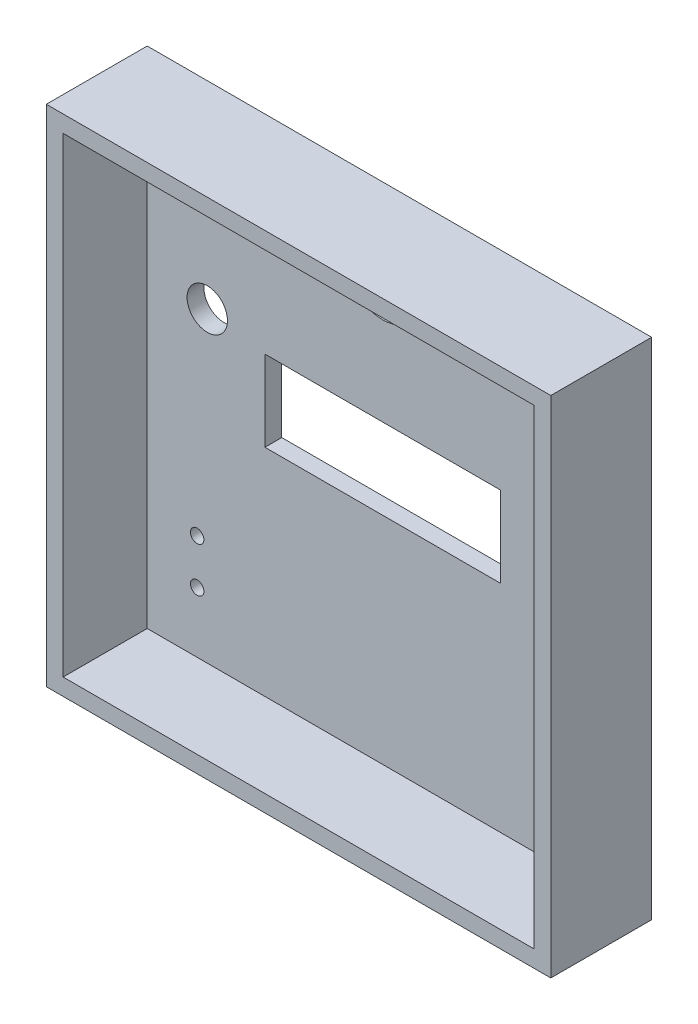
from build123d import *

# Parameters (mm, degrees)
SKETCH4_W           = 150
SKETCH4_H           = 150
BOSS_EXTRUDE1_DEPTH = 30
SHELL2_T            = -5
SKETCH5_R           = 11
CUT_EXTRUDE1_DEPTH  = 10
SKETCH6_W           = 70
SKETCH6_H           = 24
CUT_EXTRUDE2_DEPTH  = 10
SKETCH7_R           = 6
CUT_EXTRUDE3_DEPTH  = 10
SKETCH8_R           = 2.5
CUT_EXTRUDE4_DEPTH  = 10
SKETCH10_R          = 2
CUT_EXTRUDE5_DEPTH  = 10


with BuildPart() as part:
    # Sketch4 → Boss-Extrude1 (new body)
    with BuildSketch(Plane.XY):
        Rectangle(SKETCH4_W, SKETCH4_H)
    extrude(amount=BOSS_EXTRUDE1_DEPTH)

    # Shell2
    shell2_openings = [part.faces().sort_by_distance(p)[0] for p in [
        (0, 0, 30),
    ]]
    offset(amount=SHELL2_T, openings=shell2_openings, kind=Kind.INTERSECTION)

    # Sketch5 → Cut-Extrude1 (cut)
    with BuildSketch(Plane(origin=(0, 0, 0), x_dir=(-1, 0, 0), z_dir=(0, 0, -1))):
        with Locations((0, 55.503756803)):
            Circle(SKETCH5_R)
    extrude(amount=-CUT_EXTRUDE1_DEPTH, mode=Mode.SUBTRACT)

    # Sketch6 → Cut-Extrude2 (cut)
    with BuildSketch(Plane(origin=(0, 0, 0), x_dir=(-1, 0, 0), z_dir=(0, 0, -1))):
        with Locations((0, 6.168751782)):
            Rectangle(SKETCH6_W, SKETCH6_H)
    extrude(amount=-CUT_EXTRUDE2_DEPTH, mode=Mode.SUBTRACT)

    # Sketch7 → Cut-Extrude3 (cut)
    with BuildSketch(Plane(origin=(0, 0, 0), x_dir=(-1, 0, 0), z_dir=(0, 0, -1))):
        with Locations((52.142360775, 21.195860283)):
            Circle(SKETCH7_R)
    extrude(amount=-CUT_EXTRUDE3_DEPTH, mode=Mode.SUBTRACT)

    # Sketch8 → Cut-Extrude4 (cut)
    with BuildSketch(Plane(origin=(0, 0, 0), x_dir=(-1, 0, 0), z_dir=(0, 0, -1))):
        with Locations((-48.952452987, -41.390507081)):
            Circle(SKETCH8_R)
    extrude(amount=-CUT_EXTRUDE4_DEPTH, mode=Mode.SUBTRACT)

    # Sketch10 → Cut-Extrude5 (cut)
    with BuildSketch(Plane(origin=(0, 0, 0), x_dir=(-1, 0, 0), z_dir=(0, 0, -1))):
        with Locations((55.147282701, -52.031429677)):
            Circle(SKETCH10_R)
        with Locations((55.147282701, -38.731179224)):
            Circle(SKETCH10_R)
    extrude(amount=-CUT_EXTRUDE5_DEPTH, mode=Mode.SUBTRACT)


solid = part.part
